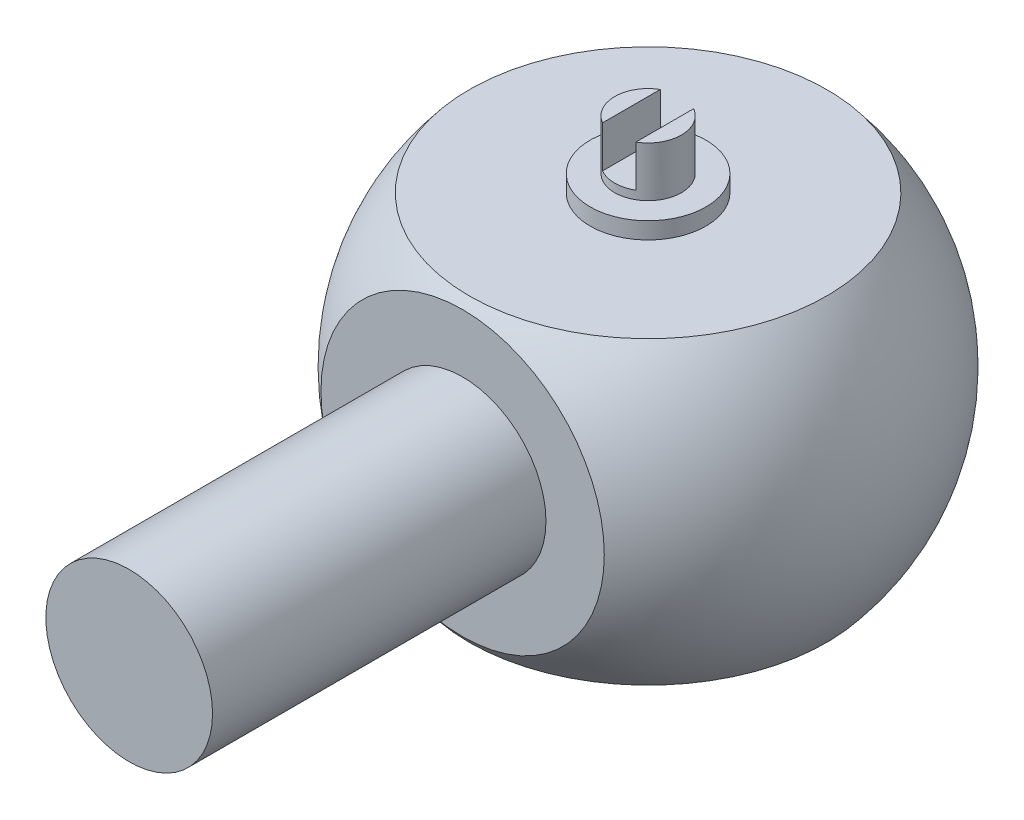
from build123d import *

# Parameters (mm, degrees)
CORTAR_EXTRUIR1_DEPTH      = 15
CORTAR_EXTRUIR1_DEPTH_BACK = 10
CROQUIS2_W                 = 7.74823864
CROQUIS2_H                 = 16.99585586
CROQUIS4_R                 = 5
SALIENTE_EXTRUIR2_DEPTH    = 20
CORTAR_EXTRUIR2_DEPTH      = 2
CORTAR_EXTRUIR2_DEPTH_BACK = 2
CROQUIS6_W                 = 2
CROQUIS6_H                 = 2.5


with BuildPart() as part:
    # Croquis1 → Revolución2 (revolve)
    with BuildSketch(Plane.XY, mode=Mode.PRIVATE) as revoluci_n2_sk:
        with BuildLine():
            Line((0, 9), (0, -11))
            Line((0, -11), (0, -12))
            Line((0, -12), (0, -15))
            Line((0, -15), (2, -15))
            Line((2, -15), (2, -10))
            Line((2, -10), (3.455214016, -10))
            Line((3.455214016, -10), (3.455214016, -9))
            Line((3.455214016, -9), (10.723805295, -9))
            ThreePointArc((10.723805295, -9), (14, 0), (10.723805295, 9))
            Line((10.723805295, 9), (3.47289893, 9))
            Line((3.47289893, 9), (3.47289893, 10))
            Line((3.47289893, 10), (2, 10))
            Line((2, 10), (2, 13))
            Line((2, 13), (0, 13))
            Line((0, 13), (0, 10))
            Line((0, 10), (0, 9))
        make_face()
    revolve(revoluci_n2_sk.sketch.rotate(Axis((0, 9, 0), (0, -1, 0)), 90), axis=Axis((0, 9, 0), (0, -1, 0)))

    # Croquis2 → Cortar-Extruir1 (cut, two sides: drawn at the far end of the back side and taken through both)
    with BuildSketch(Plane(origin=(0, 0, 0), x_dir=(0, 0, -1), z_dir=(1, 0, 0)).offset(-CORTAR_EXTRUIR1_DEPTH_BACK)):
        with Locations((-15, 0)):
            Rectangle(CROQUIS2_W, CROQUIS2_H)
    extrude(amount=CORTAR_EXTRUIR1_DEPTH + CORTAR_EXTRUIR1_DEPTH_BACK, mode=Mode.SUBTRACT)

    # Croquis4 → Saliente-Extruir2 (add)
    with BuildSketch(Plane.XY.offset(11.12588068)):
        Circle(CROQUIS4_R)
    extrude(amount=SALIENTE_EXTRUIR2_DEPTH)

    # Croquis6 → Cortar-Extruir2 (cut, two sides: drawn at the far end of the back side and taken through both)
    with BuildSketch(Plane.XY.offset(-CORTAR_EXTRUIR2_DEPTH_BACK)):
        with Locations((0, 11.75)):
            Rectangle(CROQUIS6_W, CROQUIS6_H)
    extrude(amount=CORTAR_EXTRUIR2_DEPTH + CORTAR_EXTRUIR2_DEPTH_BACK, mode=Mode.SUBTRACT)


solid = part.part
